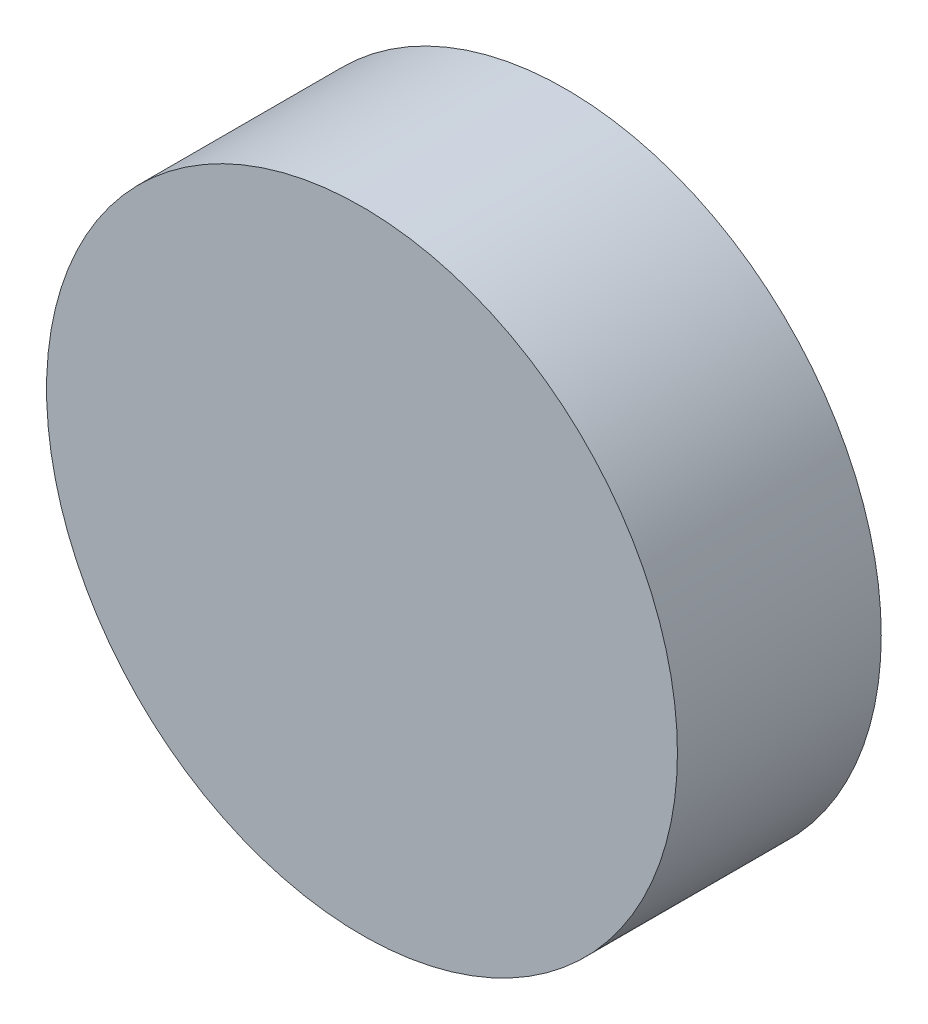
from build123d import *

# Parameters (mm, degrees)
ESQUISSE1_R          = 6.5
ESQUISSE1_R_2        = 4.5
BASE_EXTRUSION_DEPTH = 4
ESQUISSE2_R          = 6.5
BOSS_EXTRU_1_DEPTH   = 0.2


with BuildPart() as part:
    # Esquisse1 → Base-Extrusion (new body)
    with BuildSketch(Plane.XY):
        Circle(ESQUISSE1_R)
        Circle(ESQUISSE1_R_2, mode=Mode.SUBTRACT)
    extrude(amount=BASE_EXTRUSION_DEPTH)

    # Esquisse2 → Boss.-Extru.1 (add)
    with BuildSketch(Plane.XY.offset(4)):
        Circle(ESQUISSE2_R)
    extrude(amount=BOSS_EXTRU_1_DEPTH)


solid = part.part
